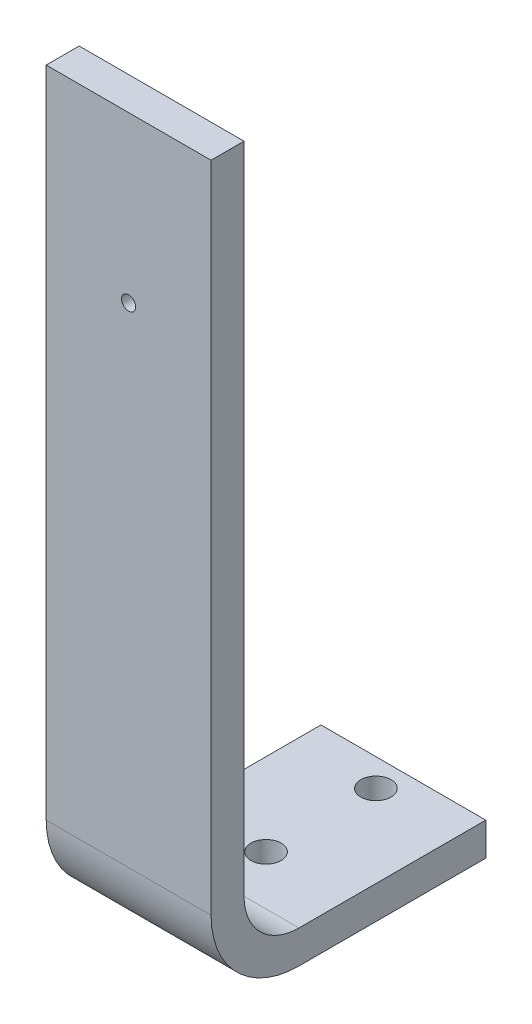
from build123d import *

# Parameters (mm, degrees)
BOSS_EXTRUDE1_DEPTH   = 30
FILLET1_R             = 10
FILLET2_R             = 16
M5_CLEARANCE_HOLE1_D  = 5.5
F_5_40_TAPPED_HOLE1_D = 2.5781


with BuildPart() as part:
    # Sketch1 → Boss-Extrude1 (new body)
    with BuildSketch(Plane(origin=(0, 0, 0), x_dir=(0, 0, -1), z_dir=(1, 0, 0))):
        Polygon((0, 0), (50, 0), (50, 6), (6, 6), (6, 135), (0, 135), align=None)
    extrude(amount=BOSS_EXTRUDE1_DEPTH)

    # Fillet1
    fillet1_edges = [part.edges().sort_by_distance(p)[0] for p in [
        (15, 6, -6),
    ]]
    fillet(fillet1_edges, radius=FILLET1_R)

    # Fillet2
    fillet2_edges = [part.edges().sort_by_distance(p)[0] for p in [
        (15, 0, 0),
    ]]
    fillet(fillet2_edges, radius=FILLET2_R)

    # M5 Clearance Hole1 (through all)
    with Locations(Plane(origin=(0, 6, 0), x_dir=(1, 0, 0), z_dir=(0, 1, 0))):
        with Locations((15, 45), (15, 25)):
            Hole(M5_CLEARANCE_HOLE1_D / 2)

    # #5-40 Tapped Hole1 (through all)
    with Locations(Plane.XY):
        with Locations((15, 105)):
            Hole(F_5_40_TAPPED_HOLE1_D / 2)


solid = part.part
